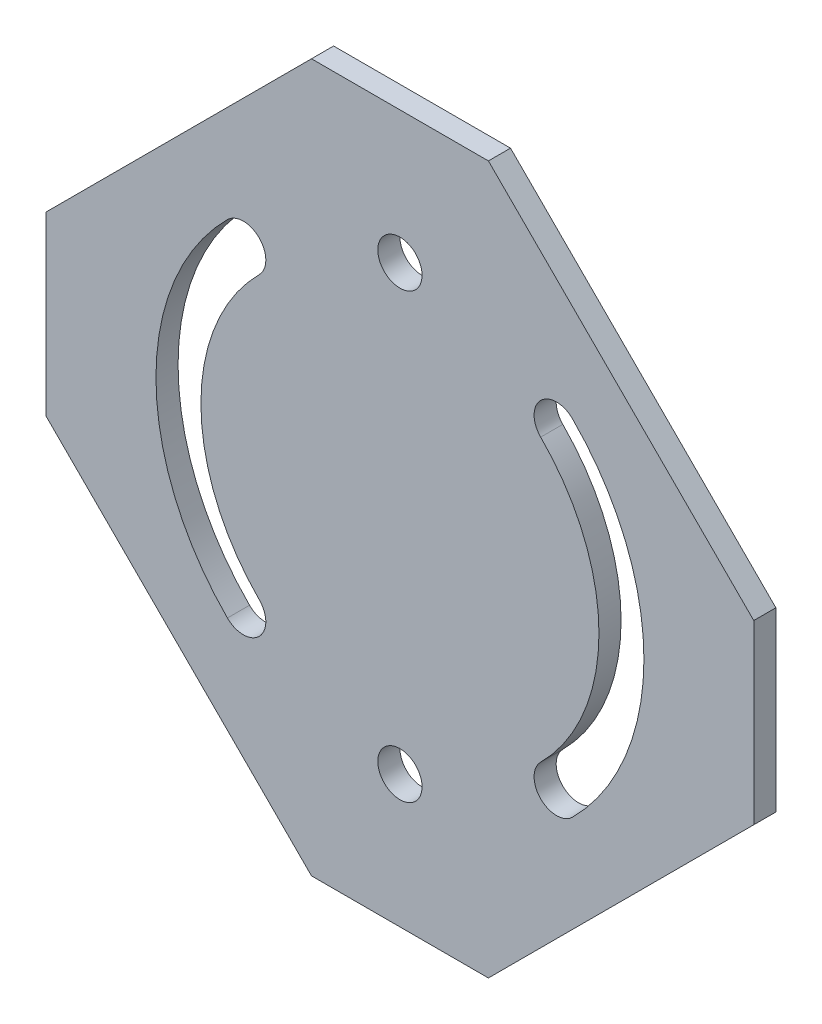
from build123d import *

# Parameters (mm, degrees)
SKETCH_1_R      = 3
EXTRUDE_1_DEPTH = 3


with BuildPart() as part:
    # 草图1 → 凸台-拉伸1 (new body)
    with BuildSketch(Plane.XY):
        Polygon((-12, -48), (12, -48), (48, -12), (48, 12), (12, 48), (-12, 48), (-48, 12), (-48, -12), align=None)
        with Locations((0, 30.05)):
            Circle(SKETCH_1_R, mode=Mode.SUBTRACT)
        with Locations((0, -30.05)):
            Circle(SKETCH_1_R, mode=Mode.SUBTRACT)
        with BuildLine():
            ThreePointArc((19.091883092, -19.091883092), (27, 0), (19.091883092, 19.091883092))
            ThreePointArc((19.091883092, 19.091883092), (19.091883092, 23.405234457), (23.405234457, 23.405234457))
            ThreePointArc((23.405234457, 23.405234457), (33.1, 0), (23.405234457, -23.405234457))
            ThreePointArc((23.405234457, -23.405234457), (19.091883092, -23.405234457), (19.091883092, -19.091883092))
        make_face(mode=Mode.SUBTRACT)
        with BuildLine():
            ThreePointArc((-19.091883092, 19.091883092), (-27, 0), (-19.091883092, -19.091883092))
            ThreePointArc((-19.091883092, -19.091883092), (-19.091883092, -23.405234457), (-23.405234457, -23.405234457))
            ThreePointArc((-23.405234457, -23.405234457), (-33.1, 0), (-23.405234457, 23.405234457))
            ThreePointArc((-23.405234457, 23.405234457), (-19.091883092, 23.405234457), (-19.091883092, 19.091883092))
        make_face(mode=Mode.SUBTRACT)
    extrude(amount=EXTRUDE_1_DEPTH)


solid = part.part
